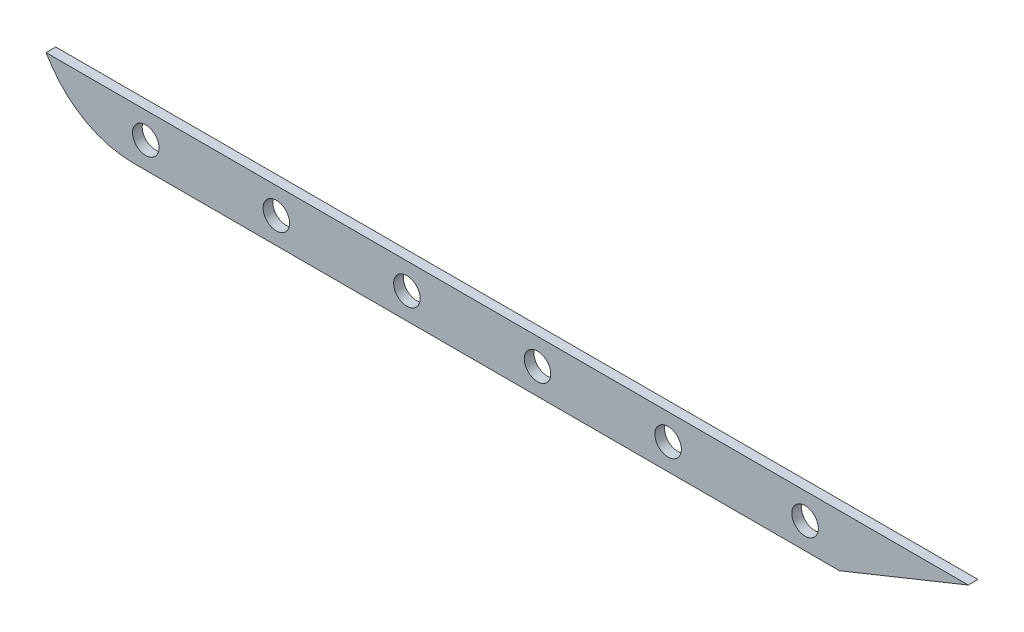
from build123d import *

# Parameters (mm, degrees)
BOSS_EXTRUDE1_DEPTH = 4.7625
SKETCH1_4_R         = 6.5
CUT_EXTRUDE1_DEPTH  = 439.920211962
CUT_EXTRUDE4_REACH  = 440.92
FILLET1_R           = 48
CUT_EXTRUDE5_DEPTH  = 10


with BuildPart() as part:
    # Sketch1 → Boss-Extrude1 (new body)
    with BuildSketch(Plane.XY):
        Polygon((428.120588235, 28.570833333), (0, 28.570833333), (-98.879411765, 3.850980392), (-31.879411765, -96.649019608), (366, -96.649019608), (403.120588235, -71.149019608), align=None)
    extrude(amount=BOSS_EXTRUDE1_DEPTH)

    # Sketch1<4> → Cut-Extrude1 (cut, through all)
    with BuildSketch(Plane.XY):
        with Locations((0, -83.899019608)):
            Circle(SKETCH1_4_R)
        with Locations((64, -83.899019608)):
            Circle(SKETCH1_4_R)
        with Locations((128, -83.899019608)):
            Circle(SKETCH1_4_R)
        with Locations((192, -83.899019608)):
            Circle(SKETCH1_4_R)
        with Locations((256, -83.899019608)):
            Circle(SKETCH1_4_R)
        with Locations((323.120588235, -83.899019608)):
            Circle(SKETCH1_4_R)
    extrude(amount=CUT_EXTRUDE1_DEPTH, mode=Mode.SUBTRACT)

    # Sketch7 → Cut-Extrude4 (cut, up to next)
    with BuildSketch(Plane.XY.offset(4.7625), mode=Mode.PRIVATE) as cut_extrude4_sk1:
        Polygon((-48.879411765, -71.149019608), (403.120588235, -71.149019608), (428.120588235, 28.570833333), (0, 28.570833333), (-98.879411765, 3.850980392), align=None)
    cut_extrude4_tool1 = extrude(cut_extrude4_sk1.sketch, amount=-CUT_EXTRUDE4_REACH, mode=Mode.PRIVATE) & part.part
    add(cut_extrude4_tool1.solids().sort_by_distance((173.467548, -20.947586, 4.7625))[0], mode=Mode.SUBTRACT)

    # Fillet1
    fillet1_edges = [part.edges().sort_by_distance(p)[0] for p in [
        (-31.879411765, -96.649019608, 2.38125),
    ]]
    fillet(fillet1_edges, radius=FILLET1_R)

    # Sketch8 → Cut-Extrude5 (cut)
    with BuildSketch(Plane.XY.offset(4.7625)):
        Polygon((403.120588235, -71.149019608), (340.005873473, -96.649019608), (366, -96.649019608), align=None)
    extrude(amount=-CUT_EXTRUDE5_DEPTH, mode=Mode.SUBTRACT)


solid = part.part
